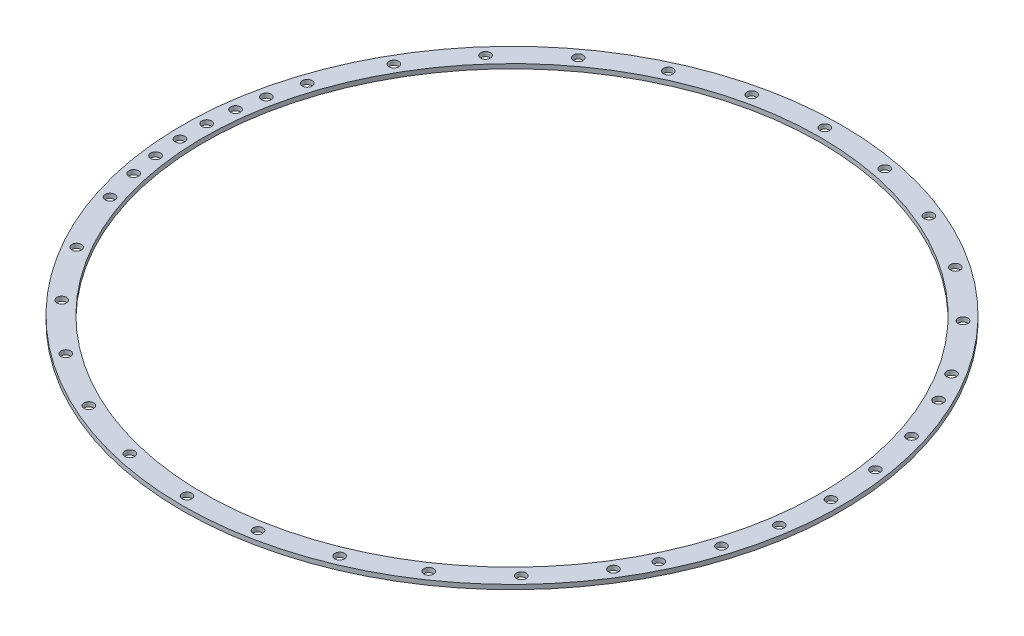
from build123d import *

# Parameters (mm, degrees)
SKETCH1_W          = 7
SKETCH1_H          = 1.5
SKETCH3_R          = 1.6
CUT_EXTRUDE2_DEPTH = 155.156576246


with BuildPart() as part:
    # Sketch1 → Revolve1 (revolve)
    with BuildSketch(Plane.XY, mode=Mode.PRIVATE) as revolve1_sk:
        with Locations((-105.5, 3.925)):
            Rectangle(SKETCH1_W, SKETCH1_H)
    revolve(revolve1_sk.sketch.rotate(Axis((0, -200069.047495165, 0), (0, 1, 0)), 270), axis=Axis((0, -200069.047495165, 0), (0, 1, 0)))

    # Sketch3 → Cut-Extrude2 (cut, through all)
    with BuildSketch(Plane(origin=(0, 4.675, 0), x_dir=(1, 0, 0), z_dir=(0, 1, 0))):
        with Locations(Location((-103.194571877, -21.934683381, 0), (0, 0, 270))):
            Circle(SKETCH3_R)
        with Locations(Location((-105.407458575, -4.417881468, 0), (0, 0, 270))):
            Circle(SKETCH3_R)
        with Locations(Location((-104.668100989, -13.222656141, 0), (0, 0, 270))):
            Circle(SKETCH3_R)
        with Locations(Location((-100.336462469, 32.601292907, 0), (0, 0, 270))):
            Circle(SKETCH3_R)
        with Locations(Location((104.295371407, 15.897342642, 0), (0, 0, 270))):
            Circle(SKETCH3_R)
        with Locations(Location((100.708995202, 31.43164465, 0), (0, 0, 270))):
            Circle(SKETCH3_R)
        with Locations(Location((94.822771885, 46.248155986, 0), (0, 0, 270))):
            Circle(SKETCH3_R)
        with Locations(Location((-103.194571877, 21.934683381, 0), (0, 0, 270))):
            Circle(SKETCH3_R)
        with Locations(Location((-104.668100989, 13.222656141, 0), (0, 0, 270))):
            Circle(SKETCH3_R)
        with Locations(Location((-105.407458575, 4.417881468, 0), (0, 0, 270))):
            Circle(SKETCH3_R)
        with Locations(Location((89.469074145, -55.906482377, 0), (0, 0, 270))):
            Circle(SKETCH3_R)
        with Locations(Location((-44.130594647, 95.826617472, 0), (0, 0, 270))):
            Circle(SKETCH3_R)
        with Locations(Location((-62.82106423, 84.757087545, 0), (0, 0, 270))):
            Circle(SKETCH3_R)
        with Locations(Location((-78.848228037, 70.094271773, 0), (0, 0, 270))):
            Circle(SKETCH3_R)
        with Locations(Location((-91.532612735, 52.45980181, 0), (0, 0, 270))):
            Circle(SKETCH3_R)
        with Locations(Location((94.822771885, -46.248155986, 0), (0, 0, 270))):
            Circle(SKETCH3_R)
        with Locations(Location((100.708995202, -31.43164465, 0), (0, 0, 270))):
            Circle(SKETCH3_R)
        with Locations(Location((104.295371407, -15.897342642, 0), (0, 0, 270))):
            Circle(SKETCH3_R)
        with Locations(Location((105.5, 0, 0), (0, 0, 270))):
            Circle(SKETCH3_R)
        with Locations(Location((76.122528254, -73.04526468, 0), (0, 0, 270))):
            Circle(SKETCH3_R)
        with Locations(Location((89.469074145, 55.906482377, 0), (0, 0, 270))):
            Circle(SKETCH3_R)
        with Locations(Location((76.122528254, 73.04526468, 0), (0, 0, 270))):
            Circle(SKETCH3_R)
        with Locations(Location((59.54875959, 87.08728513, 0), (0, 0, 270))):
            Circle(SKETCH3_R)
        with Locations(Location((40.450414858, 97.437230758, 0), (0, 0, 270))):
            Circle(SKETCH3_R)
        with Locations(Location((19.637170436, 103.656314507, 0), (0, 0, 270))):
            Circle(SKETCH3_R)
        with Locations(Location((-2.008593938, 105.480877653, 0), (0, 0, 270))):
            Circle(SKETCH3_R)
        with Locations(Location((-23.569203757, 102.833567643, 0), (0, 0, 270))):
            Circle(SKETCH3_R)
        with Locations(Location((-91.532612735, -52.45980181, 0), (0, 0, 270))):
            Circle(SKETCH3_R)
        with Locations(Location((-62.82106423, -84.757087545, 0), (0, 0, 270))):
            Circle(SKETCH3_R)
        with Locations(Location((-44.130594647, -95.826617472, 0), (0, 0, 270))):
            Circle(SKETCH3_R)
        with Locations(Location((-23.569203757, -102.833567643, 0), (0, 0, 270))):
            Circle(SKETCH3_R)
        with Locations(Location((-2.008593938, -105.480877653, 0), (0, 0, 270))):
            Circle(SKETCH3_R)
        with Locations(Location((19.637170436, -103.656314507, 0), (0, 0, 270))):
            Circle(SKETCH3_R)
        with Locations(Location((40.450414858, -97.437230758, 0), (0, 0, 270))):
            Circle(SKETCH3_R)
        with Locations(Location((59.54875959, -87.08728513, 0), (0, 0, 270))):
            Circle(SKETCH3_R)
        with Locations(Location((-78.848228037, -70.094271773, 0), (0, 0, 270))):
            Circle(SKETCH3_R)
        with Locations(Location((-100.336462469, -32.601292907, 0), (0, 0, 270))):
            Circle(SKETCH3_R)
    extrude(amount=-CUT_EXTRUDE2_DEPTH, mode=Mode.SUBTRACT)


solid = part.part
